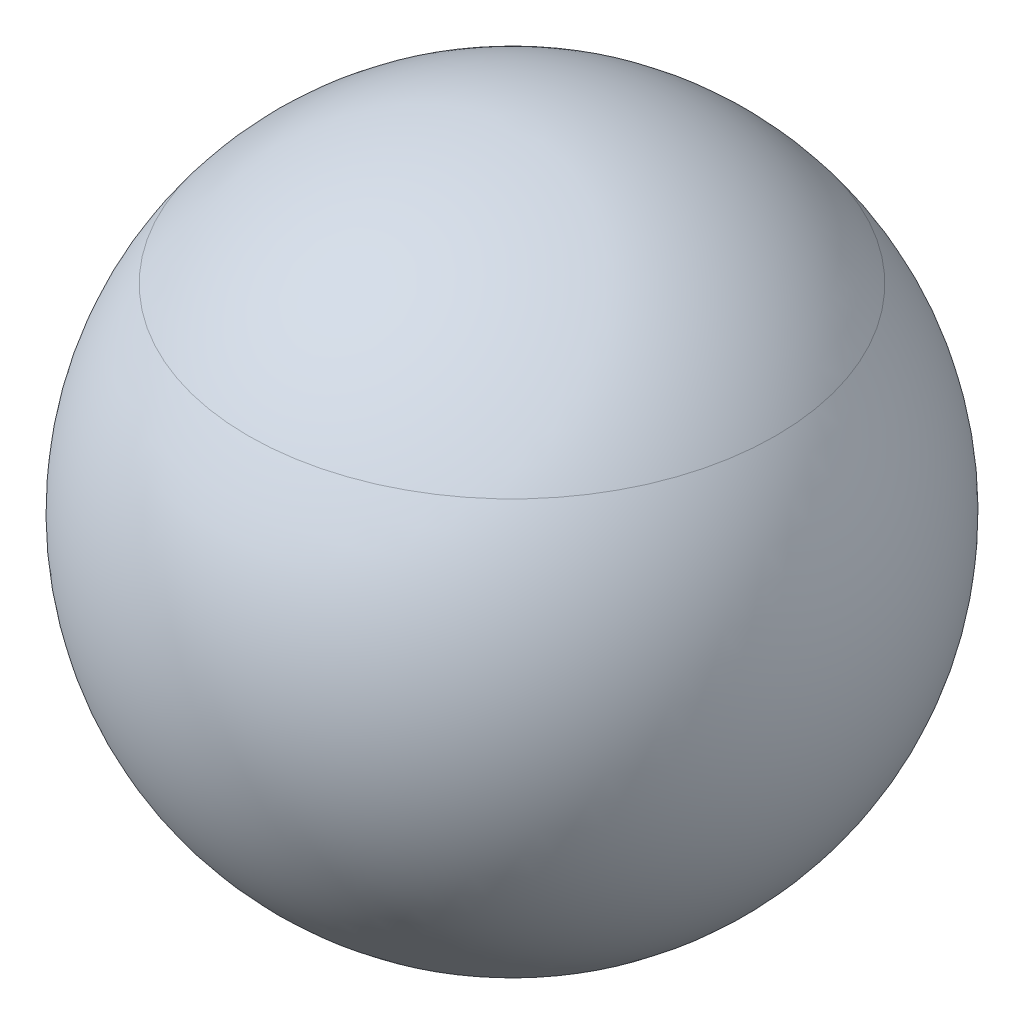
from build123d import *


with BuildPart() as part:
    # Sketch1 → Revolve1 (revolve)
    with BuildSketch(Plane.XY):
        with BuildLine():
            Line((0, 30), (0, 0))
            ThreePointArc((0, 0), (15, 15), (0, 30))
        make_face()
    revolve(axis=Axis((0, 30, 0), (0, -1, 0)))


with BuildPart() as body_2:
    # Split1: the piece on the far side of the plane
    add(part.part)
    split(bisect_by=Plane.ZX.offset(24), keep=Keep.BOTTOM)


with BuildPart() as part_1:
    add(part.part)

    # Split1
    split(bisect_by=Plane.ZX.offset(24), keep=Keep.TOP)


solid = Compound([body_2.part, part_1.part])
